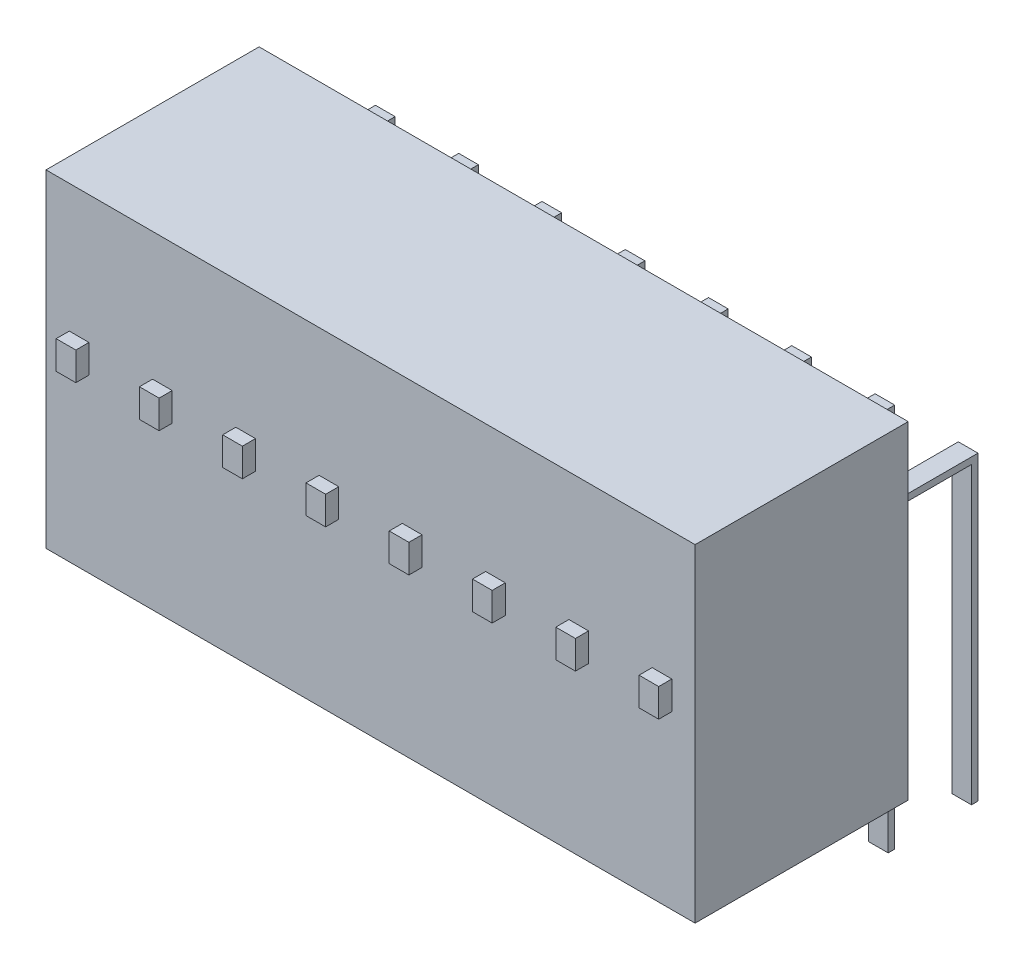
from build123d import *

# Parameters (mm, degrees)
SKETCH_1_W               = 19.8
SKETCH_1_H               = 10
EXTRUDE_1_DEPTH          = 6.9
SKETCH_2_W               = 0.6
SKETCH_2_H               = 0.2
PATTERN_LINEAR_1_COUNT   = 4
PATTERN_LINEAR_1_PITCH   = 2.54
MIRROR_1_COPY_1_SKETCH_W = 0.6
MIRROR_1_COPY_1_SKETCH_H = 0.2
MIRROR_1_COPY_2_SKETCH_W = 0.6
MIRROR_1_COPY_2_SKETCH_H = 0.2
MIRROR_1_COPY_3_SKETCH_W = 0.6
MIRROR_1_COPY_3_SKETCH_H = 0.2
SKETCH_5_W               = 0.6
SKETCH_5_H               = 0.2
PATTERN_LINEAR_2_COUNT   = 4
PATTERN_LINEAR_2_PITCH   = 2.54
MIRROR_2_COPY_1_SKETCH_W = 0.6
MIRROR_2_COPY_1_SKETCH_H = 0.2
MIRROR_2_COPY_2_SKETCH_W = 0.6
MIRROR_2_COPY_2_SKETCH_H = 0.2
MIRROR_2_COPY_3_SKETCH_W = 0.6
MIRROR_2_COPY_3_SKETCH_H = 0.2
MIRROR_2_COPY_4_SKETCH_W = 0.6
MIRROR_2_COPY_4_SKETCH_H = 0.2
SKETCH_7_W               = 0.71
SKETCH_7_H               = 0.4
SKETCH_7_W_2             = 1.94
CUT_EXTRUDE_1_DEPTH      = 24.230368056
SKETCH_8_W               = 0.4
SKETCH_8_H               = 3.904109304
SKETCH_8_H_2             = 5.232387761
CUT_EXTRUDE_2_DEPTH      = 24.230368056


with BuildPart() as part:
    # 草图1 → 凸台-拉伸1 (new body)
    with BuildSketch(Plane.XY):
        with Locations((9.9, 5)):
            Rectangle(SKETCH_1_W, SKETCH_1_H)
    extrude(amount=EXTRUDE_1_DEPTH)

    # 扫描2: sweep along a path in 草图3
    with BuildLine(Plane(origin=(11.17, 0, 0), x_dir=(0, 0, -1), z_dir=(1, 0, 0))) as sweep_2_path:
        Line((0, 2.022879956), (0.5, 2.022879956))
        Line((0.5, 2.022879956), (0.5, -1.8))
    # 草图2 → 扫描2 (sweep)
    with BuildSketch(Plane(origin=(0, 0, 0), x_dir=(-1, 0, 0), z_dir=(0, 0, -1))):
        with Locations((-11.17, 1.72257922)):
            Rectangle(SKETCH_2_W, SKETCH_2_H)
    sweep_2 = sweep(path=sweep_2_path.line, transition=Transition.RIGHT)

    # 阵列(线性)1: 扫描2 ×4
    with Locations(*[(i * PATTERN_LINEAR_1_PITCH, 0, 0) for i in range(1, PATTERN_LINEAR_1_COUNT)]):
        add(sweep_2)

    # 镜向1: 扫描2 across plane
    add(sweep_2.mirror(Plane(origin=(9.9, 0, 0), x_dir=(0, 0, 1), z_dir=(1, 0, 0))))

    # 镜向1 copy 1: sweep along a path in 镜向1 copy 1 path
    with BuildLine(Plane(origin=(6.09, 0, 0), x_dir=(0, 0, -1), z_dir=(-1, 0, 0))) as mirror_1_copy_1_path:
        Line((0, -2.022879956), (0.5, -2.022879956))
        Line((0.5, -2.022879956), (0.5, 1.8))
    # 镜向1 copy 1 sketch → 镜向1 copy 1 (sweep)
    with BuildSketch(Plane(origin=(17.26, 0, 0), x_dir=(1, 0, 0), z_dir=(0, 0, -1))):
        with Locations((-11.17, -1.72257922)):
            Rectangle(MIRROR_1_COPY_1_SKETCH_W, MIRROR_1_COPY_1_SKETCH_H)
    sweep(path=mirror_1_copy_1_path.line, transition=Transition.RIGHT)

    # 镜向1 copy 2: sweep along a path in 镜向1 copy 2 path
    with BuildLine(Plane(origin=(3.55, 0, 0), x_dir=(0, 0, -1), z_dir=(-1, 0, 0))) as mirror_1_copy_2_path:
        Line((0, -2.022879956), (0.5, -2.022879956))
        Line((0.5, -2.022879956), (0.5, 1.8))
    # 镜向1 copy 2 sketch → 镜向1 copy 2 (sweep)
    with BuildSketch(Plane(origin=(14.72, 0, 0), x_dir=(1, 0, 0), z_dir=(0, 0, -1))):
        with Locations((-11.17, -1.72257922)):
            Rectangle(MIRROR_1_COPY_2_SKETCH_W, MIRROR_1_COPY_2_SKETCH_H)
    sweep(path=mirror_1_copy_2_path.line, transition=Transition.RIGHT)

    # 镜向1 copy 3: sweep along a path in 镜向1 copy 3 path
    with BuildLine(Plane(origin=(1.01, 0, 0), x_dir=(0, 0, -1), z_dir=(-1, 0, 0))) as mirror_1_copy_3_path:
        Line((0, -2.022879956), (0.5, -2.022879956))
        Line((0.5, -2.022879956), (0.5, 1.8))
    # 镜向1 copy 3 sketch → 镜向1 copy 3 (sweep)
    with BuildSketch(Plane(origin=(12.18, 0, 0), x_dir=(1, 0, 0), z_dir=(0, 0, -1))):
        with Locations((-11.17, -1.72257922)):
            Rectangle(MIRROR_1_COPY_3_SKETCH_W, MIRROR_1_COPY_3_SKETCH_H)
    sweep(path=mirror_1_copy_3_path.line, transition=Transition.RIGHT)

    # 扫描3: sweep along a path in 草图6
    with BuildLine(Plane(origin=(11.17, 0, 0), x_dir=(0, 0, -1), z_dir=(1, 0, 0))) as sweep_3_path:
        Line((0, 7.391909702), (2.839699264, 7.391909702))
        Line((2.839699264, 7.391909702), (2.839699264, -1.8))
    # 草图5 → 扫描3 (sweep)
    with BuildSketch(Plane(origin=(0, 0, 0), x_dir=(-1, 0, 0), z_dir=(0, 0, -1))):
        with Locations((-11.17, 7.291909702)):
            Rectangle(SKETCH_5_W, SKETCH_5_H)
    sweep_3 = sweep(path=sweep_3_path.line, transition=Transition.RIGHT)

    # 阵列(线性)2: 扫描3 ×4
    with Locations(*[(i * PATTERN_LINEAR_2_PITCH, 0, 0) for i in range(1, PATTERN_LINEAR_2_COUNT)]):
        add(sweep_3)

    # 镜向2 copy 1: sweep along a path in 镜向2 copy 1 path
    with BuildLine(Plane(origin=(6.09, 0, 0), x_dir=(0, 0, -1), z_dir=(-1, 0, 0))) as mirror_2_copy_1_path:
        Line((0, -7.391909702), (2.839699264, -7.391909702))
        Line((2.839699264, -7.391909702), (2.839699264, 1.8))
    # 镜向2 copy 1 sketch → 镜向2 copy 1 (sweep)
    with BuildSketch(Plane(origin=(17.26, 0, 0), x_dir=(1, 0, 0), z_dir=(0, 0, -1))):
        with Locations((-11.17, -7.291909702)):
            Rectangle(MIRROR_2_COPY_1_SKETCH_W, MIRROR_2_COPY_1_SKETCH_H)
    sweep(path=mirror_2_copy_1_path.line, transition=Transition.RIGHT)

    # 镜向2 copy 2: sweep along a path in 镜向2 copy 2 path
    with BuildLine(Plane(origin=(3.55, 0, 0), x_dir=(0, 0, -1), z_dir=(-1, 0, 0))) as mirror_2_copy_2_path:
        Line((0, -7.391909702), (2.839699264, -7.391909702))
        Line((2.839699264, -7.391909702), (2.839699264, 1.8))
    # 镜向2 copy 2 sketch → 镜向2 copy 2 (sweep)
    with BuildSketch(Plane(origin=(14.72, 0, 0), x_dir=(1, 0, 0), z_dir=(0, 0, -1))):
        with Locations((-11.17, -7.291909702)):
            Rectangle(MIRROR_2_COPY_2_SKETCH_W, MIRROR_2_COPY_2_SKETCH_H)
    sweep(path=mirror_2_copy_2_path.line, transition=Transition.RIGHT)

    # 镜向2 copy 3: sweep along a path in 镜向2 copy 3 path
    with BuildLine(Plane(origin=(1.01, 0, 0), x_dir=(0, 0, -1), z_dir=(-1, 0, 0))) as mirror_2_copy_3_path:
        Line((0, -7.391909702), (2.839699264, -7.391909702))
        Line((2.839699264, -7.391909702), (2.839699264, 1.8))
    # 镜向2 copy 3 sketch → 镜向2 copy 3 (sweep)
    with BuildSketch(Plane(origin=(12.18, 0, 0), x_dir=(1, 0, 0), z_dir=(0, 0, -1))):
        with Locations((-11.17, -7.291909702)):
            Rectangle(MIRROR_2_COPY_3_SKETCH_W, MIRROR_2_COPY_3_SKETCH_H)
    sweep(path=mirror_2_copy_3_path.line, transition=Transition.RIGHT)

    # 镜向2 copy 4: sweep along a path in 镜向2 copy 4 path
    with BuildLine(Plane(origin=(8.63, 0, 0), x_dir=(0, 0, -1), z_dir=(-1, 0, 0))) as mirror_2_copy_4_path:
        Line((0, -7.391909702), (2.839699264, -7.391909702))
        Line((2.839699264, -7.391909702), (2.839699264, 1.8))
    # 镜向2 copy 4 sketch → 镜向2 copy 4 (sweep)
    with BuildSketch(Plane(origin=(19.8, 0, 0), x_dir=(1, 0, 0), z_dir=(0, 0, -1))):
        with Locations((-11.17, -7.291909702)):
            Rectangle(MIRROR_2_COPY_4_SKETCH_W, MIRROR_2_COPY_4_SKETCH_H)
    sweep(path=mirror_2_copy_4_path.line, transition=Transition.RIGHT)

    # 草图7 → 切除-拉伸1 (cut, through all)
    with BuildSketch(Plane.XZ):
        with Locations((0.355, 6.7)):
            Rectangle(SKETCH_7_W, SKETCH_7_H)
        with Locations((2.28, 6.7)):
            Rectangle(SKETCH_7_W_2, SKETCH_7_H)
        with Locations((4.82, 6.7)):
            Rectangle(SKETCH_7_W_2, SKETCH_7_H)
        with Locations((9.9, 6.7)):
            Rectangle(SKETCH_7_W_2, SKETCH_7_H)
        with Locations((7.36, 6.7)):
            Rectangle(SKETCH_7_W_2, SKETCH_7_H)
        with Locations((12.44, 6.7)):
            Rectangle(SKETCH_7_W_2, SKETCH_7_H)
        with Locations((14.98, 6.7)):
            Rectangle(SKETCH_7_W_2, SKETCH_7_H)
        with Locations((17.52, 6.7)):
            Rectangle(SKETCH_7_W_2, SKETCH_7_H)
        with Locations((19.445, 6.7)):
            Rectangle(SKETCH_7_W, SKETCH_7_H)
    extrude(amount=-CUT_EXTRUDE_1_DEPTH, mode=Mode.SUBTRACT)

    # 草图8 → 切除-拉伸2 (cut, through all)
    with BuildSketch(Plane(origin=(19.8, 0, 0), x_dir=(0, 0, -1), z_dir=(1, 0, 0))):
        with Locations((-6.7, 8.047945348)):
            Rectangle(SKETCH_8_W, SKETCH_8_H)
        with Locations((-6.7, 2.616193881)):
            Rectangle(SKETCH_8_W, SKETCH_8_H_2)
    extrude(amount=-CUT_EXTRUDE_2_DEPTH, mode=Mode.SUBTRACT)


solid = part.part
